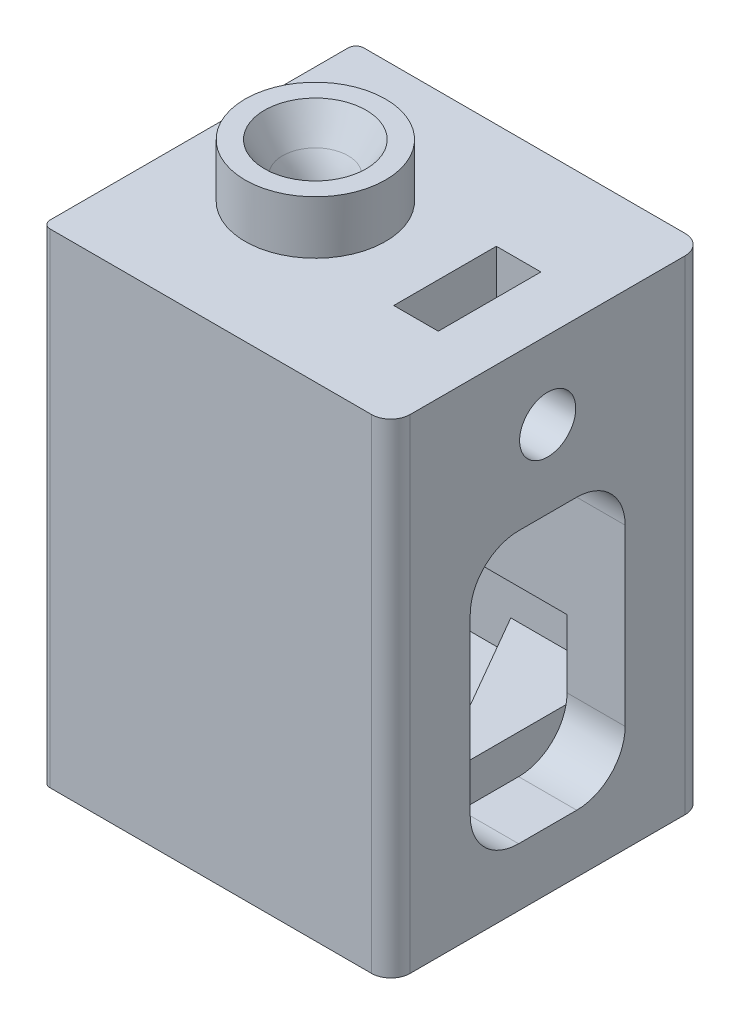
from build123d import *

# Parameters (mm, degrees)
SKETCH1_W                  = 12
SKETCH1_H                  = 13
BOSS_EXTRUDE1_DEPTH        = 19
SKETCH2_R                  = 4
CUT_EXTRUDE1_DEPTH         = 16
CUT_EXTRUDE2_START         = -2
SKETCH3_W                  = 12
SKETCH3_H                  = 13
CUT_EXTRUDE2_DEPTH         = 6
SKETCH5_W                  = 12
SKETCH5_H                  = 13
BOSS_EXTRUDE2_DEPTH        = 5
FILLET1_R                  = 2
FILLET4_R                  = 2
SKETCH21_W                 = 2.5
SKETCH21_H                 = 8
SKETCH21_W_2               = 9
SKETCH21_H_2               = 1.5
BOSS_EXTRUDE4_DEPTH        = 1
FILLET3_R                  = 0.5
FILLET7_R                  = 0.5
FILLET5_R                  = 0.5
SKETCH23_R                 = 4
BOSS_EXTRUDE5_DEPTH        = 1
BOSS_EXTRUDE6_DEPTH        = 13
BOSS_EXTRUDE7_DEPTH        = 25
SKETCH11_W                 = 2.3
SKETCH11_H                 = 5.3
CUT_EXTRUDE4_DEPTH         = 7
SKETCH34_W                 = 13.5
SKETCH34_H                 = 6
CUT_EXTRUDE5_DEPTH         = 15
M2_5_CLEARANCE_HOLE1_D     = 2.9
M2_5_CLEARANCE_HOLE1_DEPTH = 13.378752102
M2_5_CLEARANCE_HOLE1_TIP   = 0.871247898
FILLET8_R                  = 0.4
SKETCH31_R                 = 3.625
SKETCH31_R_2               = 2.625
BOSS_EXTRUDE8_DEPTH        = 2.75
FILLET9_R                  = 1
SKETCH9_R                  = 1
CUT_EXTRUDE6_DEPTH         = 29.889617512
CUT_EXTRUDE8_DEPTH         = 12
FILLET10_R                 = 5
BOSS_EXTRUDE9_DEPTH        = 2


with BuildPart() as part:
    # Sketch1 → Boss-Extrude1 (new body)
    with BuildSketch(Plane(origin=(0, 0, 0), x_dir=(1, 0, 0), z_dir=(0, 1, 0))):
        Rectangle(SKETCH1_W, SKETCH1_H)
    extrude(amount=BOSS_EXTRUDE1_DEPTH)

    # Sketch2 → Cut-Extrude1 (cut)
    with BuildSketch(Plane.XZ):
        with Locations(Location((0, 0, 0), (0, 0, 270))):
            Circle(SKETCH2_R)
    extrude(amount=-CUT_EXTRUDE1_DEPTH, mode=Mode.SUBTRACT)

    # Sketch3 → Cut-Extrude2 (cut)
    with BuildSketch(Plane.XZ.offset(CUT_EXTRUDE2_START)):
        Rectangle(SKETCH3_W, SKETCH3_H)
    extrude(amount=-CUT_EXTRUDE2_DEPTH, mode=Mode.SUBTRACT)


with BuildPart() as cut_extrude2_piece_1:
    # of the separate pieces the step leaves, piece 1, a body of its own (cut_extrude2_pieces)
    add(part.part.solids().sort_by_distance((-6, 8, 6.5))[0])

    # Sketch5 → Boss-Extrude2 (add)
    with BuildSketch(Plane(origin=(0, 19, 0), x_dir=(1, 0, 0), z_dir=(0, 1, 0))):
        Rectangle(SKETCH5_W, SKETCH5_H)
    extrude(amount=BOSS_EXTRUDE2_DEPTH)

    # Fillet1
    fillet1_edges = [cut_extrude2_piece_1.edges().sort_by_distance(p)[0] for p in [
        (-6, 16, -6.5),
        (-6, 16, 6.5),
    ]]
    fillet(fillet1_edges, radius=FILLET1_R)



with BuildPart() as cut_extrude2_piece_2:
    # of the separate pieces the step leaves, piece 2, a body of its own (cut_extrude2_pieces)
    add(part.part.solids().sort_by_distance((-6, 0, 6.5))[0])

    # Fillet4
    fillet4_edges = [cut_extrude2_piece_2.edges().sort_by_distance(p)[0] for p in [
        (-6, 1, 6.5),
        (-6, 1, -6.5),
    ]]
    fillet(fillet4_edges, radius=FILLET4_R)

    # Sketch21 → Boss-Extrude4 (add)
    with BuildSketch(Plane.ZY.offset(6)):
        with Locations((-3.25, 18)):
            Rectangle(SKETCH21_W, SKETCH21_H)
        with Locations((3.25, 18)):
            Rectangle(SKETCH21_W, SKETCH21_H)
        with Locations((0, 0.75)):
            Rectangle(SKETCH21_W_2, SKETCH21_H_2)
    extrude(amount=BOSS_EXTRUDE4_DEPTH)


with BuildPart() as boss_extrude4_piece_1:
    # of the separate pieces the step leaves, piece 1, a body of its own (boss_extrude4_pieces)
    add(cut_extrude2_piece_2.part.solids().sort_by_distance((-4, 0, 6.5))[0])

    # Fillet5
    fillet5_edges = [boss_extrude4_piece_1.edges().sort_by_distance(p)[0] for p in [
        (-7, 0.75, -4.5),
        (-7, 0.75, 4.5),
    ]]
    fillet(fillet5_edges, radius=FILLET5_R)

    # Sketch23 → Boss-Extrude5 (add)
    with BuildSketch(Plane.XZ):
        with BuildLine():
            Line((-7, 4), (-7, -4))
            ThreePointArc((-7, -4), (-6.853553391, -4.353553391), (-6.5, -4.5))
            Line((-6.5, -4.5), (-6, -4.5))
            ThreePointArc((-6, -4.5), (-5.414213562, -5.914213562), (-4, -6.5))
            Line((-4, -6.5), (6, -6.5))
            Line((6, -6.5), (6, 6.5))
            Line((6, 6.5), (-4, 6.5))
            ThreePointArc((-4, 6.5), (-5.414213562, 5.914213562), (-6, 4.5))
            Line((-6, 4.5), (-6.5, 4.5))
            ThreePointArc((-6.5, 4.5), (-6.853553391, 4.353553391), (-7, 4))
        make_face()
        with Locations(Location((0, 0, 0), (0, 0, 270))):
            Circle(SKETCH23_R, mode=Mode.SUBTRACT)
    extrude(amount=BOSS_EXTRUDE5_DEPTH)


with BuildPart() as boss_extrude4_piece_2:
    # of the separate pieces the step leaves, piece 2, a body of its own (boss_extrude4_pieces)
    add(cut_extrude2_piece_2.part.solids().sort_by_distance((-6, 22, -4.5))[0])

    # Fillet7
    fillet7_edges = [boss_extrude4_piece_2.edges().sort_by_distance(p)[0] for p in [
        (-7, 18, -2),
        (-7, 22, -3.25),
        (-7, 18, -4.5),
        (-7, 14, -3.25),
    ]]
    fillet(fillet7_edges, radius=FILLET7_R)


with BuildPart() as boss_extrude4_piece_3:
    # of the separate pieces the step leaves, piece 3, a body of its own (boss_extrude4_pieces)
    add(cut_extrude2_piece_2.part.solids().sort_by_distance((-6, 22, 2))[0])

    # Fillet3
    fillet3_edges = [boss_extrude4_piece_3.edges().sort_by_distance(p)[0] for p in [
        (-7, 22, 3.25),
        (-7, 18, 2),
        (-7, 14, 3.25),
        (-7, 18, 4.5),
    ]]
    fillet(fillet3_edges, radius=FILLET3_R)


with BuildPart() as cut_extrude2_piece_1_1:
    add(cut_extrude2_piece_1.part)

    add(boss_extrude4_piece_1.part)  # Boss-Extrude6 merges Boss-Extrude4 piece 1
    # Sketch26 → Boss-Extrude6 (add, through all)
    with BuildSketch(Plane(origin=(0, 0, -6.5), x_dir=(-1, 0, 0), z_dir=(0, 0, -1))):
        Polygon((-6, 24), (-12, 24), (-12, -1), (-6, -1), (-6, 2), (-9, 2), (-9, 8), (-6, 8), align=None)
    extrude(amount=-BOSS_EXTRUDE6_DEPTH)


    add(boss_extrude4_piece_2.part)  # Boss-Extrude7 merges Boss-Extrude4 piece 2

    add(boss_extrude4_piece_3.part)  # Boss-Extrude7 merges Boss-Extrude4 piece 3
    # Sketch30 → Boss-Extrude7 (add, through all)
    with BuildSketch(Plane(origin=(0, 24, 0), x_dir=(1, 0, 0), z_dir=(0, 1, 0))):
        with BuildLine():
            ThreePointArc((-6, 4.5), (-5.414213562, 5.914213562), (-4, 6.5))
            Line((-4, 6.5), (12, 6.5))
            Line((12, 6.5), (12, 8.1))
            Line((12, 8.1), (-6, 8.1))
            Line((-6, 8.1), (-6, 4.5))
        make_face()
        with BuildLine():
            Line((12, -6.5), (-4, -6.5))
            ThreePointArc((-4, -6.5), (-5.414213562, -5.914213562), (-6, -4.5))
            Line((-6, -4.5), (-6, -8.1))
            Line((-6, -8.1), (12, -8.1))
            Line((12, -8.1), (12, -6.5))
        make_face()
    extrude(amount=-BOSS_EXTRUDE7_DEPTH)

    # Sketch11 → Cut-Extrude4 (cut)
    with BuildSketch(Plane(origin=(0, 24, 0), x_dir=(1, 0, 0), z_dir=(0, 1, 0))):
        with Locations((7.85, 0)):
            Rectangle(SKETCH11_W, SKETCH11_H)
    extrude(amount=-CUT_EXTRUDE4_DEPTH, mode=Mode.SUBTRACT)

    # Sketch34 → Cut-Extrude5 (cut)
    with BuildSketch(Plane.ZY.offset(6)):
        with Locations((0, 5)):
            Rectangle(SKETCH34_W, SKETCH34_H)
    extrude(amount=-CUT_EXTRUDE5_DEPTH, mode=Mode.SUBTRACT)

    # M2.5 Clearance Hole1
    with Locations(Plane(origin=(12, 0, 0), x_dir=(0, 0, -1), z_dir=(1, 0, 0))):
        with Locations((0, 20)):
            Hole(M2_5_CLEARANCE_HOLE1_D / 2, depth=M2_5_CLEARANCE_HOLE1_DEPTH)
            with Locations((0, 0, -(M2_5_CLEARANCE_HOLE1_DEPTH + M2_5_CLEARANCE_HOLE1_TIP / 2))):  # 118° drill point
                Cone(0, M2_5_CLEARANCE_HOLE1_D / 2, M2_5_CLEARANCE_HOLE1_TIP, mode=Mode.SUBTRACT)

    # Fillet8
    fillet8_edges = [cut_extrude2_piece_1_1.edges().sort_by_distance(p)[0] for p in [
        (-6, 11.5, 8.1),
        (-6, 5, 6.75),
        (-6, 5, -6.75),
        (-6, 11.5, -8.1),
    ]]
    fillet(fillet8_edges, radius=FILLET8_R)

    # Sketch31 → Boss-Extrude8 (add)
    with BuildSketch(Plane(origin=(0, 24, 0), x_dir=(1, 0, 0), z_dir=(0, 1, 0))):
        with Locations(Location((0, 0, 0), (0, 0, 90))):
            Circle(SKETCH31_R)
        with Locations(Location((0, 0, 0), (0, 0, 270))):
            Circle(SKETCH31_R_2, mode=Mode.SUBTRACT)
    extrude(amount=BOSS_EXTRUDE8_DEPTH)

    # Fillet9
    fillet9_edges = [cut_extrude2_piece_1_1.edges().sort_by_distance(p)[0] for p in [
        (12, 11.5, 8.1),
        (12, 11.5, -8.1),
    ]]
    fillet(fillet9_edges, radius=FILLET9_R)

    # Sketch9 → Cut-Extrude6 (cut, through all)
    with BuildSketch(Plane(origin=(0, 24, 0), x_dir=(1, 0, 0), z_dir=(0, 1, 0))):
        with Locations(Location((0, 0, 0), (0, 0, 270))):
            Circle(SKETCH9_R)
    extrude(amount=-CUT_EXTRUDE6_DEPTH, mode=Mode.SUBTRACT)

    # Sketch42 → Cut-Extrude8 (cut)
    with BuildSketch(Plane(origin=(12, 0, 0), x_dir=(0, 0, -1), z_dir=(1, 0, 0))):
        with BuildLine():
            Line((-1.5, 16), (1.5, 16))
            ThreePointArc((1.5, 16), (3.267766953, 15.267766953), (4, 13.5))
            Line((4, 13.5), (4, 4.5))
            ThreePointArc((4, 4.5), (3.267766953, 2.732233047), (1.5, 2))
            Line((1.5, 2), (-1.5, 2))
            ThreePointArc((-1.5, 2), (-3.267766953, 2.732233047), (-4, 4.5))
            Line((-4, 4.5), (-4, 13.5))
            ThreePointArc((-4, 13.5), (-3.267766953, 15.267766953), (-1.5, 16))
        make_face()
    extrude(amount=-CUT_EXTRUDE8_DEPTH, mode=Mode.SUBTRACT)

    # Sketch43 → Revolve1 (revolve)
    with BuildSketch(Plane.XY, mode=Mode.PRIVATE) as revolve1_sk:
        Polygon((1, 24), (2.625, 26.75), (2.625, 24), align=None)
    revolve(revolve1_sk.sketch.rotate(Axis((0, 28.9875, 0), (0, -1, 0)), 270), axis=Axis((0, 28.9875, 0), (0, -1, 0)))

    # Fillet10
    fillet10_edges = [cut_extrude2_piece_1_1.edges().sort_by_distance(p)[0] for p in [
        (1, 24, 0),
    ]]
    fillet(fillet10_edges, radius=FILLET10_R)

    # Sketch45 → Boss-Extrude9 (add)
    with BuildSketch(Plane(origin=(0, 2, 0), x_dir=(1, 0, 0), z_dir=(0, 1, 0))):
        Polygon((3.695041723, -6.4), (7.390083446, 0), (3.695041723, 6.4), (9, 6.4), (9, -6.4), align=None)
    extrude(amount=BOSS_EXTRUDE9_DEPTH)


solid = cut_extrude2_piece_1_1.part
